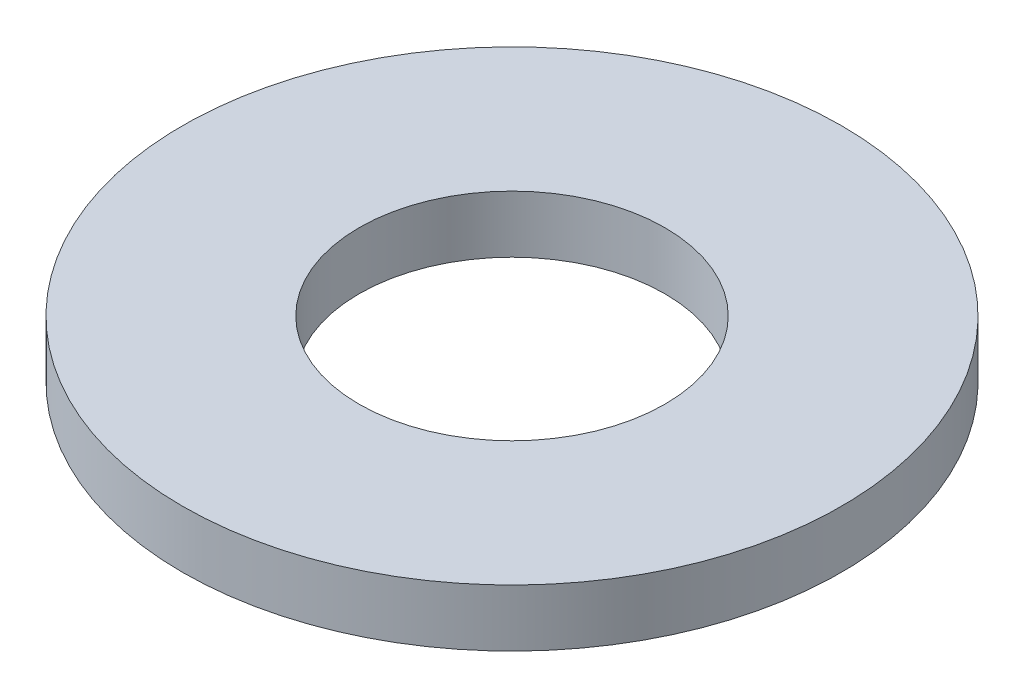
from build123d import *

# Parameters (mm, degrees)
SKETCH1_R           = 5.55625
BOSS_EXTRUDE1_DEPTH = 0.9652
SKETCH5_R           = 2.5781
CUT_EXTRUDE1_DEPTH  = 8.916782122


with BuildPart() as part:
    # Sketch1 → Boss-Extrude1 (new body)
    with BuildSketch(Plane(origin=(0, 0, 0), x_dir=(1, 0, 0), z_dir=(0, 1, 0))):
        with Locations(Location((0, 0, 0), (0, 0, 90))):
            Circle(SKETCH1_R)
    extrude(amount=BOSS_EXTRUDE1_DEPTH)

    # Sketch5 → Cut-Extrude1 (cut, through all)
    with BuildSketch(Plane(origin=(0, 0.9652, 0), x_dir=(-1, 0, 0), z_dir=(0, 1, 0))):
        with Locations(Location((0, 0, 0), (0, 0, 90))):
            Circle(SKETCH5_R)
    extrude(amount=-CUT_EXTRUDE1_DEPTH, mode=Mode.SUBTRACT)


solid = part.part
